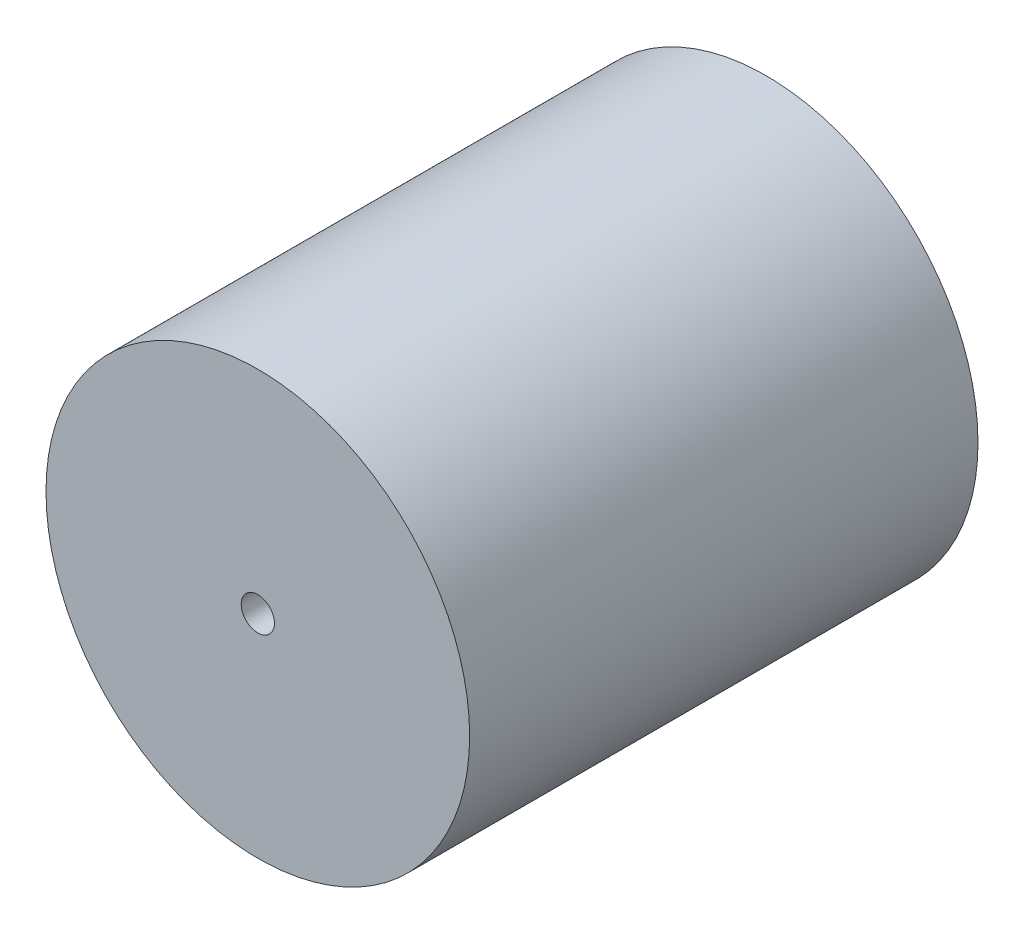
from build123d import *

# Parameters (mm, degrees)
SKETCH1_R           = 31.75
SKETCH1_R_2         = 2.4892
BOSS_EXTRUDE1_DEPTH = 38.1


with BuildPart() as part:
    # Sketch1 → Boss-Extrude1 (new, symmetric)
    with BuildSketch(Plane.XY):
        with Locations(Location((28.575, 38.1, 0), (0, 0, 180))):
            Circle(SKETCH1_R)
        with Locations(Location((28.575, 38.1, 0), (0, 0, 180))):
            Circle(SKETCH1_R_2, mode=Mode.SUBTRACT)
    extrude(amount=BOSS_EXTRUDE1_DEPTH, both=True)


solid = part.part
